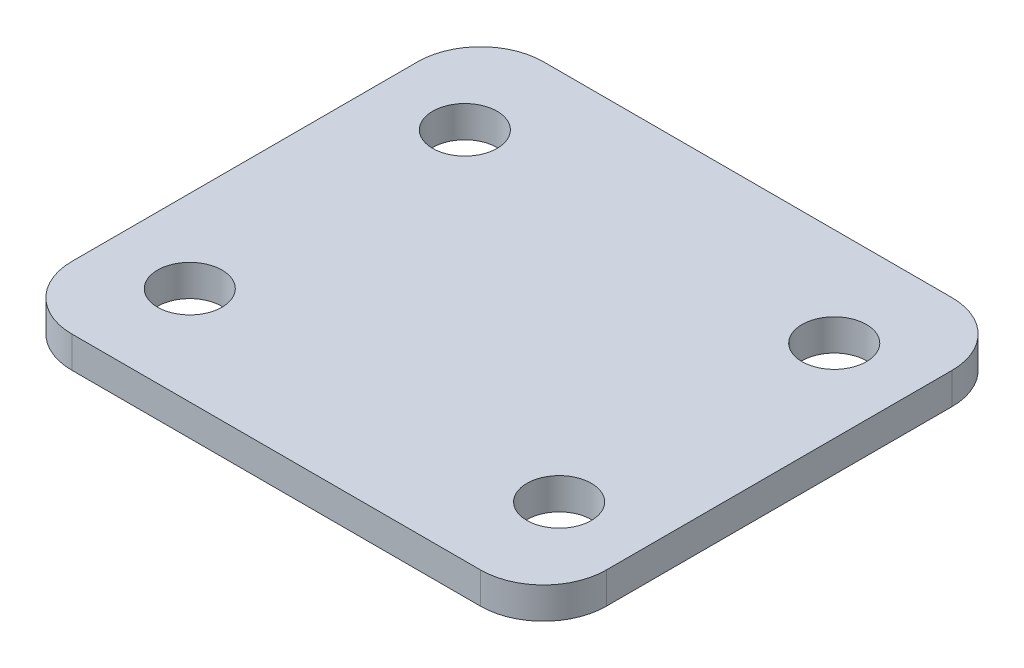
from build123d import *

# Parameters (mm, degrees)
SKETCH_1_W      = 34
SKETCH_1_H      = 30
SKETCH_1_R      = 2.05
EXTRUDE_1_DEPTH = 2
FILLET_1_R      = 4


with BuildPart() as part:
    # 草图1 → 凸台-拉伸1 (new body)
    with BuildSketch(Plane(origin=(0, 0, 0), x_dir=(1, 0, 0), z_dir=(0, 1, 0))):
        Rectangle(SKETCH_1_W, SKETCH_1_H)
        with Locations(Location((-11.75, 8.75, 0), (0, 0, 270))):
            Circle(SKETCH_1_R, mode=Mode.SUBTRACT)
        with Locations(Location((11.75, 8.75, 0), (0, 0, 270))):
            Circle(SKETCH_1_R, mode=Mode.SUBTRACT)
        with Locations(Location((11.75, -8.75, 0), (0, 0, 270))):
            Circle(SKETCH_1_R, mode=Mode.SUBTRACT)
        with Locations(Location((-11.75, -8.75, 0), (0, 0, 270))):
            Circle(SKETCH_1_R, mode=Mode.SUBTRACT)
    extrude(amount=EXTRUDE_1_DEPTH)

    # 圆角1
    fillet_1_edges = [part.edges().sort_by_distance(p)[0] for p in [
        (17, 1, 15),
        (-17, 1, 15),
        (-17, 1, -15),
        (17, 1, -15),
    ]]
    fillet(fillet_1_edges, radius=FILLET_1_R)


solid = part.part
